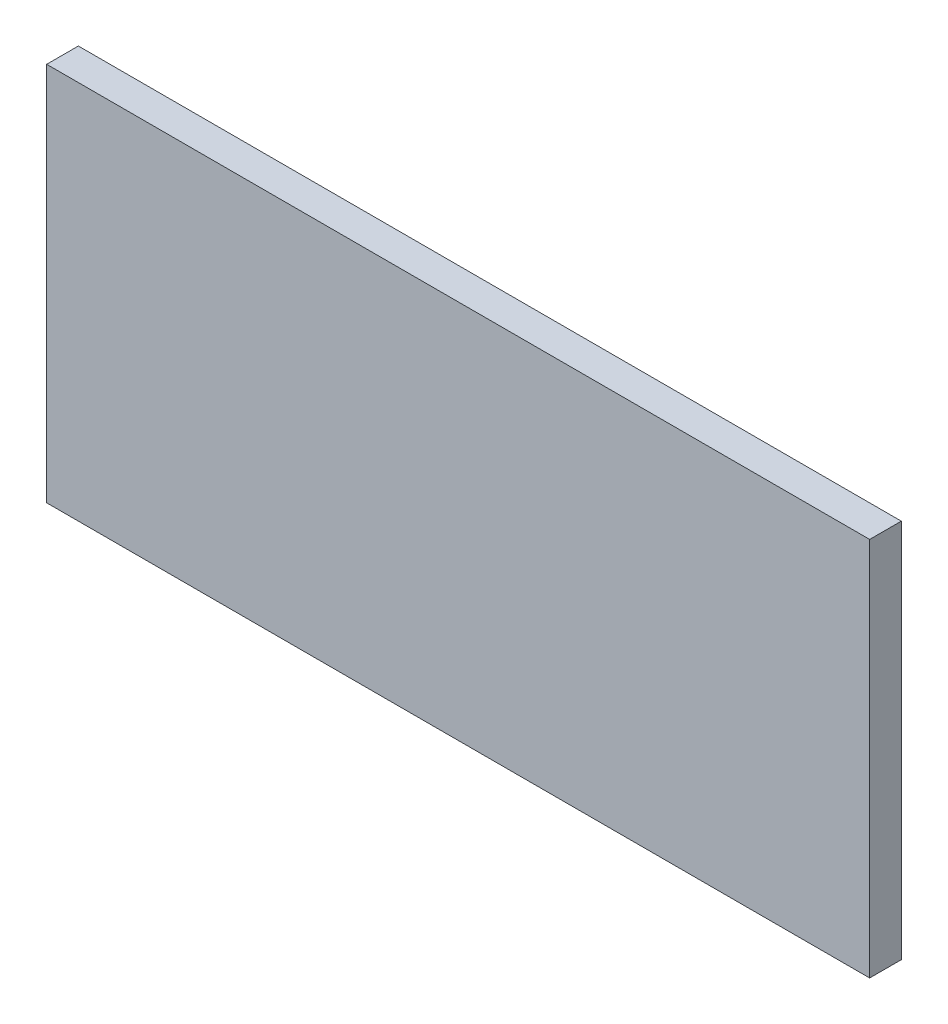
from build123d import *

# Parameters (mm, degrees)
SKETCH1_W           = 165.1
SKETCH1_H           = 76.2
BOSS_EXTRUDE1_DEPTH = 6.35


with BuildPart() as part:
    # Sketch1 → Boss-Extrude1 (new body)
    with BuildSketch(Plane.XY):
        Rectangle(SKETCH1_W, SKETCH1_H)
    extrude(amount=BOSS_EXTRUDE1_DEPTH)


solid = part.part
